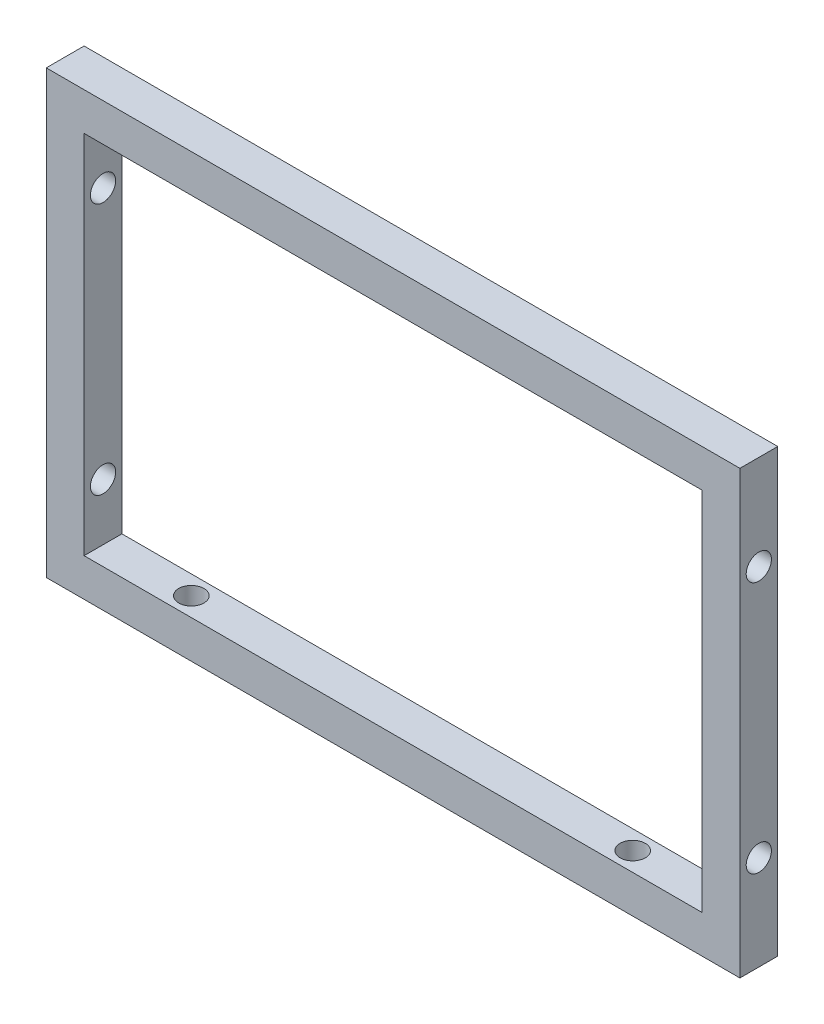
from build123d import *

# Parameters (mm, degrees)
SKETCH_1_W          = 110
SKETCH_1_H          = 70
SKETCH_1_W_2        = 98
SKETCH_1_H_2        = 58
EXTRUDE_1_DEPTH     = 6
SKETCH_3_R          = 2
CUT_EXTRUDE_2_DEPTH = 6
SKETCH_4_R          = 2
CUT_EXTRUDE_3_DEPTH = 110


with BuildPart() as part:
    # 草图1 → 凸台-拉伸1 (new body)
    with BuildSketch(Plane.XY):
        Rectangle(SKETCH_1_W, SKETCH_1_H)
        Rectangle(SKETCH_1_W_2, SKETCH_1_H_2, mode=Mode.SUBTRACT)
    extrude(amount=EXTRUDE_1_DEPTH)

    # 草图3 → 切除-拉伸2 (cut)
    with BuildSketch(Plane.XZ.offset(35)):
        with Locations(Location((-35, 3, 0), (0, 0, 270))):
            Circle(SKETCH_3_R)
        with Locations(Location((35, 3, 0), (0, 0, 270))):
            Circle(SKETCH_3_R)
    extrude(amount=-CUT_EXTRUDE_2_DEPTH, mode=Mode.SUBTRACT)

    # 草图4 → 切除-拉伸3 (cut)
    with BuildSketch(Plane(origin=(55, 0, 0), x_dir=(0, 0, -1), z_dir=(1, 0, 0))):
        with Locations((-3, 20)):
            Circle(SKETCH_4_R)
        with Locations((-3, -20)):
            Circle(SKETCH_4_R)
    extrude(amount=-CUT_EXTRUDE_3_DEPTH, mode=Mode.SUBTRACT)


solid = part.part
